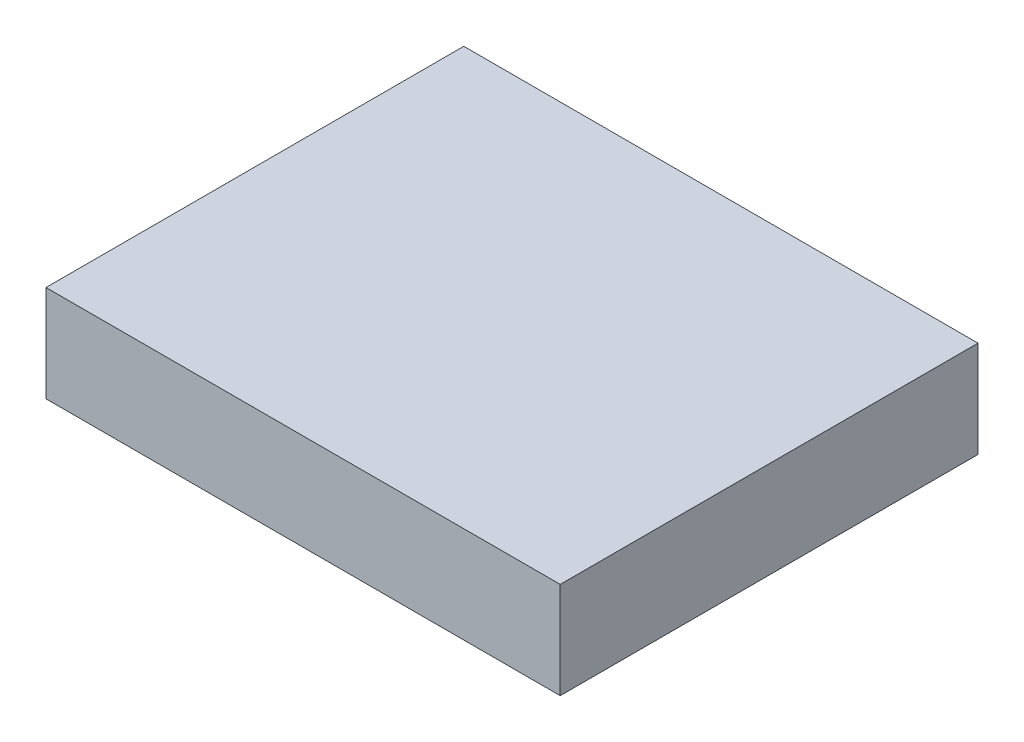
from build123d import *

# Parameters (mm, degrees)
SKETCH_1_W      = 160
SKETCH_1_H      = 130
EXTRUDE_1_DEPTH = 30


with BuildPart() as part:
    # 草图1 → 凸台-拉伸1 (new body)
    with BuildSketch(Plane(origin=(0, 0, 0), x_dir=(1, 0, 0), z_dir=(0, 1, 0))):
        Rectangle(SKETCH_1_W, SKETCH_1_H)
    extrude(amount=EXTRUDE_1_DEPTH)


solid = part.part
